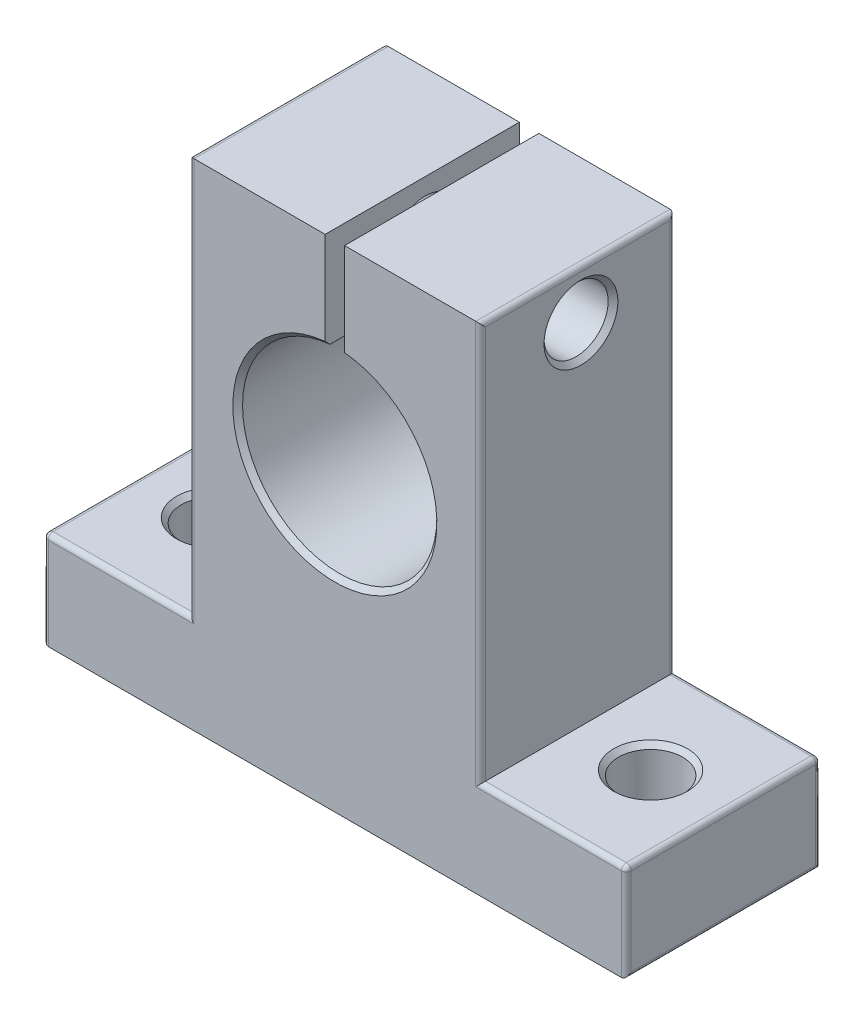
from build123d import *

# Parameters (mm, degrees)
BOSS_EXTRUDE1_DEPTH     = 10
SKETCH2_R               = 3.3
CUT_EXTRUDE1_DEPTH      = 52.778373864
CUT_EXTRUDE2_DEPTH      = 57.364882684
CUT_EXTRUDE2_DEPTH_BACK = 57.364882684
SKETCH5_R               = 3.3
CHAMFER2_SIZE           = 0.5
FILLET2_R               = 0.5


with BuildPart() as part:
    # Sketch1 → Boss-Extrude1 (new, symmetric)
    with BuildSketch(Plane.XY):
        with BuildLine():
            Line((-30, -5), (-30, 5))
            Line((-30, 5), (-15, 5))
            Line((-15, 5), (-15, 46))
            Line((-15, 46), (-1, 46))
            Line((-1, 46), (-1, 35.949874371))
            ThreePointArc((-1, 35.949874371), (0, 16), (1, 35.949874371))
            Line((1, 35.949874371), (1, 46))
            Line((1, 46), (15, 46))
            Line((15, 46), (15, 5))
            Line((15, 5), (30, 5))
            Line((30, 5), (30, -5))
            Line((30, -5), (-30, -5))
        make_face()
    extrude(amount=BOSS_EXTRUDE1_DEPTH, both=True)

    # Sketch2 → Cut-Extrude1 (cut, through all)
    with BuildSketch(Plane(origin=(0, 5, 0), x_dir=(1, 0, 0), z_dir=(0, 1, 0))):
        with Locations(Location((22.5, 0, 0), (0, 0, 180))):
            Circle(SKETCH2_R)
        with Locations((-22.5, 0)):
            Circle(SKETCH2_R)
    extrude(amount=-CUT_EXTRUDE1_DEPTH, mode=Mode.SUBTRACT)

    # Sketch5 → Cut-Extrude2 (cut, two sides: drawn at the far end of the back side and taken through both)
    with BuildSketch(Plane(origin=(-1, 0, 0), x_dir=(0, 0, -1), z_dir=(1, 0, 0)).offset(-CUT_EXTRUDE2_DEPTH_BACK)):
        with Locations((0.330734984, 40.974937186)):
            Circle(SKETCH5_R)
    extrude(amount=CUT_EXTRUDE2_DEPTH + CUT_EXTRUDE2_DEPTH_BACK, mode=Mode.SUBTRACT)

    # Chamfer2
    chamfer2_edges = [part.edges().sort_by_distance(p)[0] for p in [
        (0, 16, -10),
        (0, 16, 10),
        (25.8, 5, 0),
        (-25.8, 5, 0),
        (-15, 40.974937186, 2.969265016),
        (15, 40.974937186, 2.969265016),
    ]]
    chamfer(chamfer2_edges, length=CHAMFER2_SIZE)

    # Fillet2
    fillet2_edges = [part.edges().sort_by_distance(p)[0] for p in [
        (-22.5, 5, 10),
        (15, 25.5, -10),
        (22.5, 5, -10),
        (-30, 0, 10),
        (30, 0, -10),
        (-30, 0, -10),
        (-22.5, 5, -10),
        (-15, 25.5, -10),
        (30, 0, 10),
        (15, 46, 0),
        (30, 5, 0),
        (30, -5, 0),
        (-30, -5, 0),
        (-30, 5, 0),
        (-15, 46, 0),
        (22.5, 5, 10),
        (15, 25.5, 10),
        (-15, 25.5, 10),
    ]]
    fillet(fillet2_edges, radius=FILLET2_R)


solid = part.part
